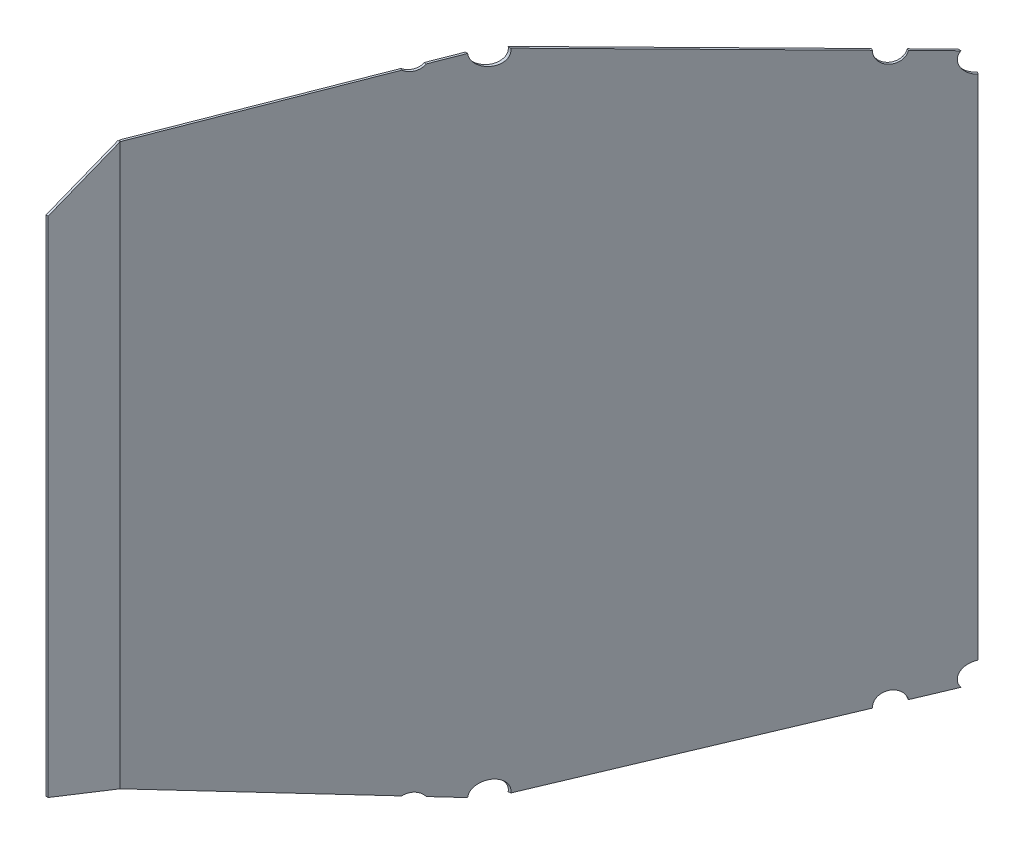
from build123d import *

# Parameters (mm, degrees)
BOSS_EXTRUDE1_DEPTH = 2.159
BOSS_EXTRUDE2_DEPTH = 2.159
SKETCH5_R           = 12.954
CUT_EXTRUDE1_DEPTH  = 621.665
SKETCH6_R           = 12.954
CUT_EXTRUDE2_DEPTH  = 1027.457309168
SKETCH7_R           = 12.954
CUT_EXTRUDE3_DEPTH  = 1027.457309168
SKETCH8_R           = 12.954
CUT_EXTRUDE4_DEPTH  = 1145.829689035


with BuildPart() as part:
    # Sketch3 → Boss-Extrude1 (new body)
    with BuildSketch(Plane(origin=(251.476706106, 0, 168.307390472), x_dir=(-0.5562007015720102, 0, 0.8310480007621723), z_dir=(-0.8310480007621723, 0, -0.5562007015720102))):
        Polygon((-187.204535341, 273.05), (-187.204535341, 0), (429.299541391, 0), (429.299541391, 279.4), (164.402521358, 323.85), align=None)
        Polygon((-187.204535341, 0), (-187.204535341, -273.05), (164.402521358, -323.85), (429.299541391, -279.4), (429.299541391, 0), align=None)
    extrude(amount=BOSS_EXTRUDE1_DEPTH)

    # Sketch5 → Cut-Extrude1 (cut)
    with BuildSketch(Plane(origin=(825.5, 177.8, 47.625), x_dir=(-0.07152915299803123, 0.013455979276857365, 0.9973477412081931), z_dir=(-0.9801553180651386, 0.18438565389344194, -0.07278381074741123))):
        Circle(SKETCH5_R)
    cut_extrude1 = extrude(amount=CUT_EXTRUDE1_DEPTH, mode=Mode.SUBTRACT)

    # Sketch6 → Cut-Extrude2 (cut, through all)
    with BuildSketch(Plane(origin=(825.5, 227.0125, 304.8), x_dir=(-0.42445842434756254, 0.047278784890198794, 0.9042122331066369), z_dir=(-0.8986546712744607, 0.1000976737805711, -0.4270834081304366))):
        Circle(SKETCH6_R)
    cut_extrude2 = extrude(amount=CUT_EXTRUDE2_DEPTH, mode=Mode.SUBTRACT)

    # Sketch7 → Cut-Extrude3 (cut, through all)
    with BuildSketch(Plane(origin=(825.5, 227.0125, 304.8), x_dir=(-0.00023887502122916035, 3.372792217408492e-05, 0.9999999709005754), z_dir=(-0.9901785863890273, 0.13980811442036903, -0.00024124437506688719))):
        Circle(SKETCH7_R)
    cut_extrude3 = extrude(amount=CUT_EXTRUDE3_DEPTH, mode=Mode.SUBTRACT)

    # Sketch8 → Cut-Extrude4 (cut, through all)
    with BuildSketch(Plane(origin=(825.5, 220.292352851, 603.464669867), x_dir=(-0.3334143845379491, 0.04979061934850228, 0.9414646793205114), z_dir=(-0.9311392123382828, 0.13905218320513943, -0.33711163965654883))):
        Circle(SKETCH8_R)
    cut_extrude4 = extrude(amount=CUT_EXTRUDE4_DEPTH, mode=Mode.SUBTRACT)

    # Mirror1: Cut-Extrude1, Cut-Extrude2, Cut-Extrude3, Cut-Extrude4 across plane
    add(cut_extrude1.mirror(Plane.ZX), mode=Mode.SUBTRACT)
    add(cut_extrude2.mirror(Plane.ZX), mode=Mode.SUBTRACT)
    add(cut_extrude3.mirror(Plane.ZX), mode=Mode.SUBTRACT)
    add(cut_extrude4.mirror(Plane.ZX), mode=Mode.SUBTRACT)


with BuildPart() as body_2:
    # Sketch4 → Boss-Extrude2 (new body)
    with BuildSketch(Plane.ZY.offset(-12.7)):
        Polygon((525.075916073, 0), (525.075916073, -279.4), (596.9, -251.012323537), (596.9, 0), align=None)
        Polygon((525.075916073, 279.4), (525.075916073, 0), (596.9, 0), (596.9, 251.012323537), align=None)
    extrude(amount=BOSS_EXTRUDE2_DEPTH)


solid = Compound([part.part, body_2.part])
